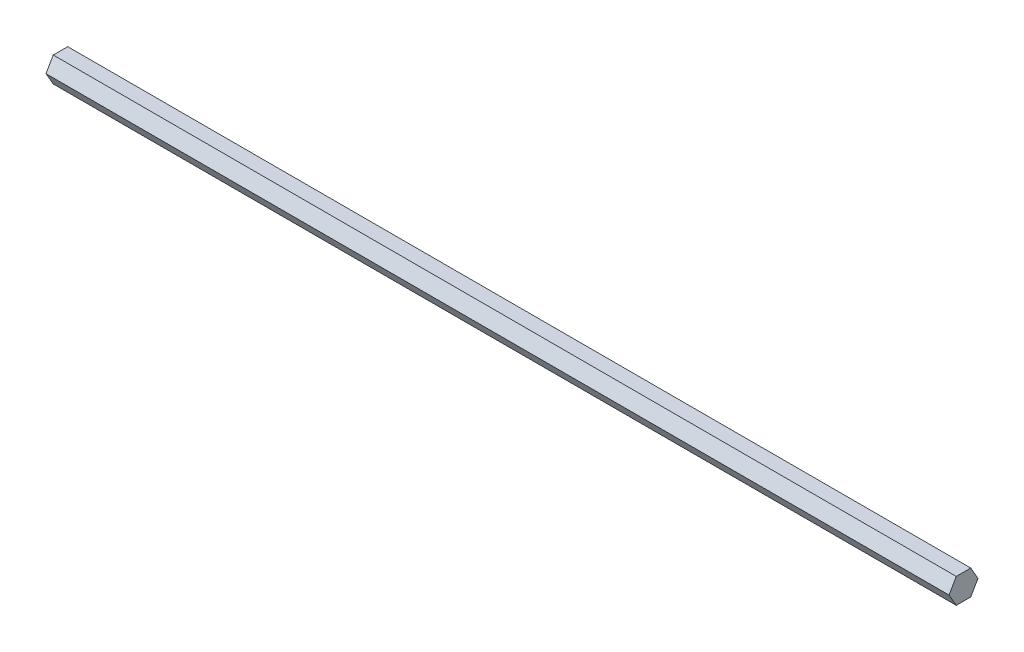
from build123d import *

# Parameters (mm, degrees)
BOSS_EXTRUDE1_DEPTH = 457.2


with BuildPart() as part:
    # Sketch2 → Boss-Extrude1 (new body)
    with BuildSketch(Plane(origin=(0, 0, 0), x_dir=(0, 0, -1), z_dir=(1, 0, 0))):
        Polygon((7.332348419, 0), (3.666174209, 6.35), (-3.666174209, 6.35), (-7.332348419, 0), (-3.666174209, -6.35), (3.666174209, -6.35), align=None)
    extrude(amount=BOSS_EXTRUDE1_DEPTH)


solid = part.part
